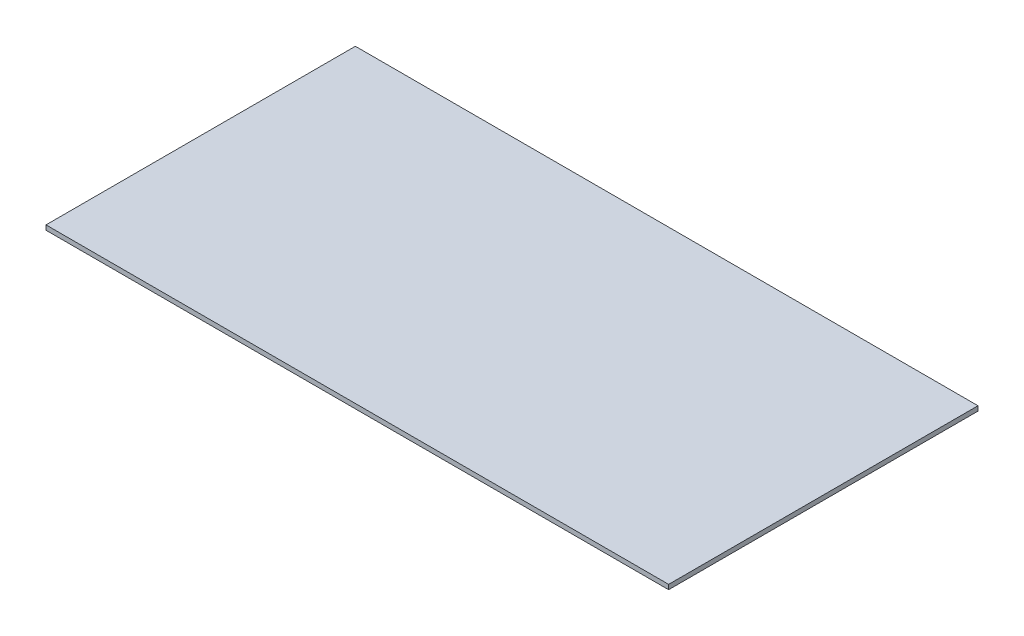
from build123d import *

# Parameters (mm, degrees)
SKETCH_1_W      = 1600
SKETCH_1_H      = 795
EXTRUDE_1_DEPTH = 12


with BuildPart() as part:
    # Эскиз1 → Бобышка-Вытянуть1 (new body)
    with BuildSketch(Plane(origin=(0, 0, 0), x_dir=(1, 0, 0), z_dir=(0, 1, 0))):
        with Locations((-2.046035806, -34.213554987)):
            Rectangle(SKETCH_1_W, SKETCH_1_H)
    extrude(amount=EXTRUDE_1_DEPTH)


solid = part.part
